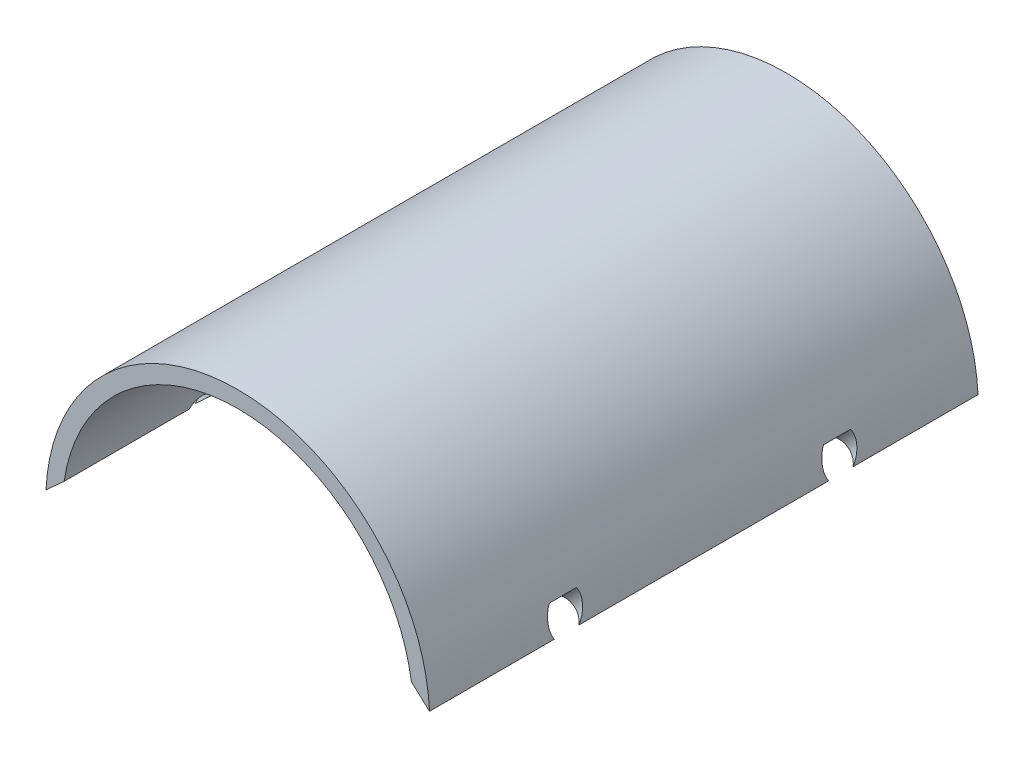
from build123d import *

# Parameters (mm, degrees)
BOSS_EXTRUDE1_DEPTH = 127
SKETCH2_R           = 4
CUT_EXTRUDE1_DEPTH  = 2
SKETCH3_R           = 4
CUT_EXTRUDE2_DEPTH  = 4.54


with BuildPart() as part:
    # Sketch1 → Boss-Extrude1 (new body)
    with BuildSketch(Plane.XY):
        with BuildLine():
            Line((-40.203883769, 5.937788296), (-44.399042974, 2.127788296))
            ThreePointArc((-44.399042974, 2.127788296), (0, 44.45), (44.399042974, 2.127788296))
            Line((44.399042974, 2.127788296), (40.203883769, 5.937788296))
            ThreePointArc((40.203883769, 5.937788296), (0, 40.64), (-40.203883769, 5.937788296))
        make_face()
    extrude(amount=BOSS_EXTRUDE1_DEPTH)

    # Sketch2 → Cut-Extrude1 (cut)
    with BuildSketch(Plane(origin=(-21.127225221, 23.263011377, 0), x_dir=(0.7402720771062569, 0.6723074087475075, 0), z_dir=(0.6723074087475075, -0.7402720771062569, 0))):
        with Locations((-28.603318705, 95.25)):
            Circle(SKETCH2_R)
        with Locations((-28.603318705, 31.75)):
            Circle(SKETCH2_R)
    extrude(amount=-CUT_EXTRUDE1_DEPTH, mode=Mode.SUBTRACT)

    # Sketch3 → Cut-Extrude2 (cut)
    with BuildSketch(Plane(origin=(21.127225221, 23.263011377, 0), x_dir=(-0.7402720771062569, 0.6723074087475075, 0), z_dir=(-0.6723074087475075, -0.7402720771062569, 0))):
        with Locations((-28.603318705, -95.25)):
            Circle(SKETCH3_R)
        with Locations((-28.603318705, -31.75)):
            Circle(SKETCH3_R)
    extrude(amount=-CUT_EXTRUDE2_DEPTH, mode=Mode.SUBTRACT)


solid = part.part
